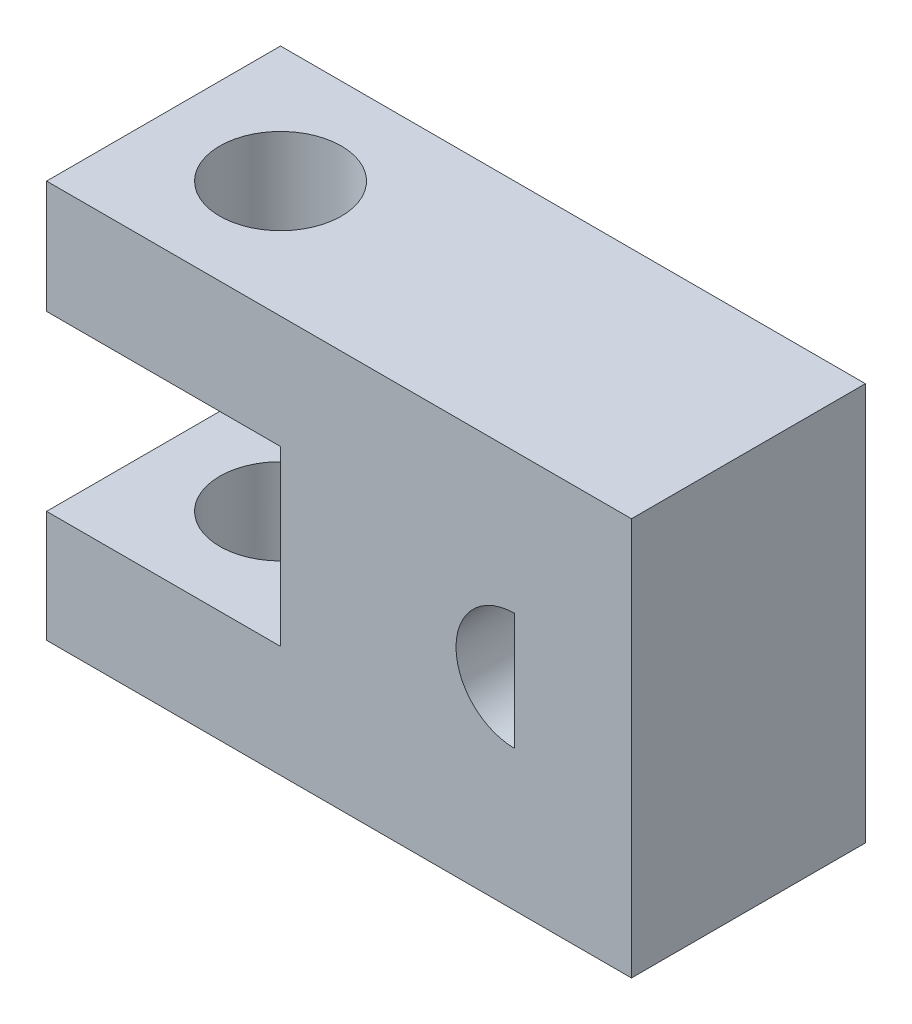
from build123d import *

# Parameters (mm, degrees)
SKETCH1_W           = 31.75
SKETCH1_H           = 21.59
BOSS_EXTRUDE1_DEPTH = 12.7
SKETCH2_W           = 12.7
SKETCH2_H           = 9.398
CUT_EXTRUDE1_DEPTH  = 12.954
SKETCH3_R           = 3.302
CUT_EXTRUDE2_DEPTH  = 25.4
CUT_EXTRUDE3_DEPTH  = 31.75


with BuildPart() as part:
    # Sketch1 → Boss-Extrude1 (new body)
    with BuildSketch(Plane.XY):
        with Locations((15.875, 10.795)):
            Rectangle(SKETCH1_W, SKETCH1_H)
    extrude(amount=BOSS_EXTRUDE1_DEPTH)

    # Sketch2 → Cut-Extrude1 (cut)
    with BuildSketch(Plane.XY.offset(12.7)):
        with Locations((6.35, 10.763108956)):
            Rectangle(SKETCH2_W, SKETCH2_H)
    extrude(amount=-CUT_EXTRUDE1_DEPTH, mode=Mode.SUBTRACT)

    # Sketch3 → Cut-Extrude2 (cut)
    with BuildSketch(Plane.XZ):
        with Locations(Location((6.35, 6.35, 0), (0, 0, 270))):
            Circle(SKETCH3_R)
    extrude(amount=-CUT_EXTRUDE2_DEPTH, mode=Mode.SUBTRACT)

    # Sketch5 → Cut-Extrude3 (cut)
    with BuildSketch(Plane.XY.offset(12.7)):
        with BuildLine():
            Line((25.4, 13.97), (25.4, 7.62))
            ThreePointArc((25.4, 7.62), (22.225, 10.795), (25.4, 13.97))
        make_face()
    extrude(amount=-CUT_EXTRUDE3_DEPTH, mode=Mode.SUBTRACT)


solid = part.part
